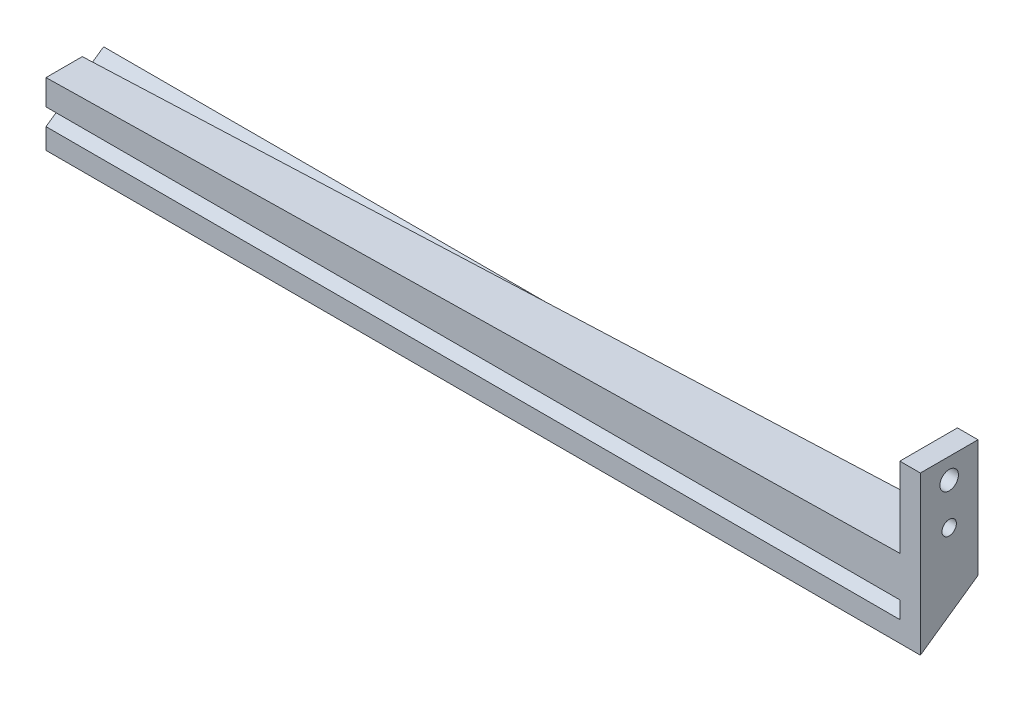
from build123d import *

# Parameters (mm, degrees)
EXTRUDE_1_DEPTH     = 425
CUT_EXTRUDE_1_DEPTH = 425
SKETCH_4_R          = 4.5
SKETCH_4_R_2        = 3.5
CUT_EXTRUDE_2_DEPTH = 425
CUT_EXTRUDE_START   = -10
CUT_EXTRUDE_3_DEPTH = 415


with BuildPart() as part:
    # 草图1 → 凸台-拉伸1 (new body)
    with BuildSketch(Plane(origin=(0, 0, 0), x_dir=(0, 0, -1), z_dir=(1, 0, 0))):
        Polygon((-31.009476957, 41.355268582), (-3.009476957, 41.355268582), (-3.009476957, -15.744731418), (-31.009476957, -35.350542488), align=None)
    extrude(amount=EXTRUDE_1_DEPTH)

    # 草图2 → 切除-拉伸1 (cut)
    with BuildSketch(Plane.XY.offset(31.009476957)):
        Polygon((415, 41.355268582), (415, 2.555268582), (0, -4.688583363), (0, 41.355268582), align=None)
    extrude(amount=-CUT_EXTRUDE_1_DEPTH, mode=Mode.SUBTRACT)

    # 草图4 → 切除-拉伸2 (cut)
    with BuildSketch(Plane(origin=(425, 0, 0), x_dir=(0, 0, -1), z_dir=(1, 0, 0))):
        with Locations((-17.009476957, 31.355268582)):
            Circle(SKETCH_4_R)
        with Locations((-17.009476957, 11.355268582)):
            Circle(SKETCH_4_R_2)
    extrude(amount=-CUT_EXTRUDE_2_DEPTH, mode=Mode.SUBTRACT)

    # 草图6 → 切除-拉伸3 (cut)
    with BuildSketch(Plane(origin=(425, 0, 0), x_dir=(0, 0, -1), z_dir=(1, 0, 0)).offset(CUT_EXTRUDE_START)):
        Polygon((-31.009476957, -25.34019086), (-3.009476957, -5.73437979), (-3.009476957, 2.566887414), (-31.009476957, -17.038923656), align=None)
    extrude(amount=-CUT_EXTRUDE_3_DEPTH, mode=Mode.SUBTRACT)


solid = part.part
